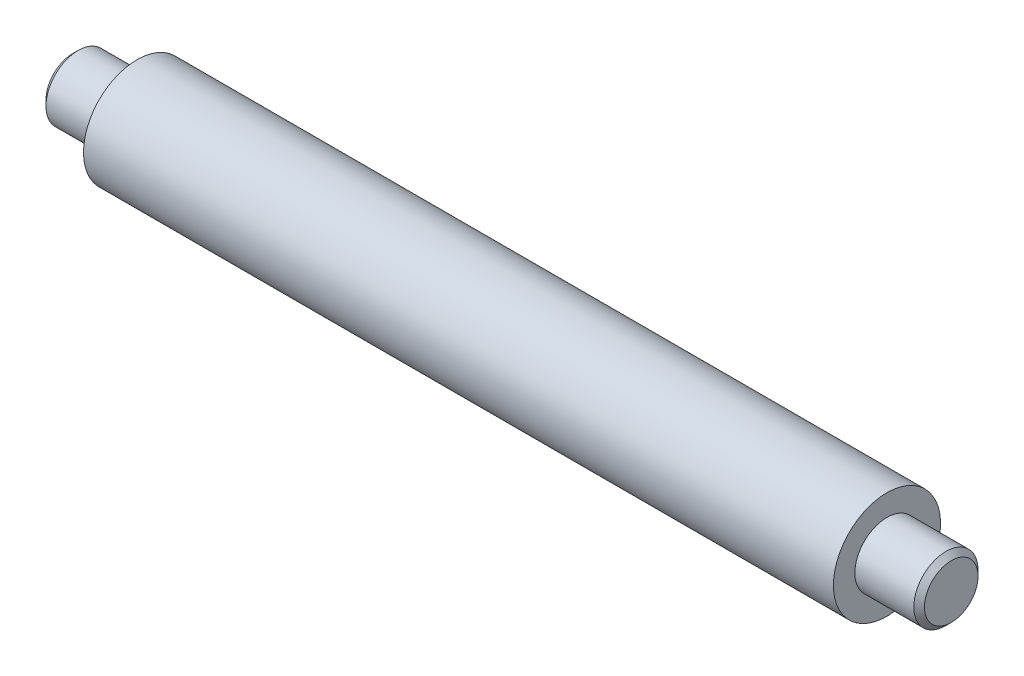
from build123d import *

# Parameters (mm, degrees)
CHAMFER2_SIZE = 0.25


with BuildPart() as part:
    # Sketch1 → Revolve1 (revolve)
    with BuildSketch(Plane.XY, mode=Mode.PRIVATE) as revolve1_sk:
        Polygon((-20.5, 0), (-20.5, 1.5), (-17.5, 1.5), (-17.5, 2.5), (17.5, 2.5), (17.5, 1.5), (20.5, 1.5), (20.5, 0), align=None)
    revolve(revolve1_sk.sketch.rotate(Axis((-39.77575721, 0, 0), (1, 0, 0)), 90), axis=Axis((-39.77575721, 0, 0), (1, 0, 0)))

    # Chamfer2
    chamfer2_edges = [part.edges().sort_by_distance(p)[0] for p in [
        (20.5, 0, -1.5),
        (-20.5, 0, -1.5),
    ]]
    chamfer(chamfer2_edges, length=CHAMFER2_SIZE)


solid = part.part
